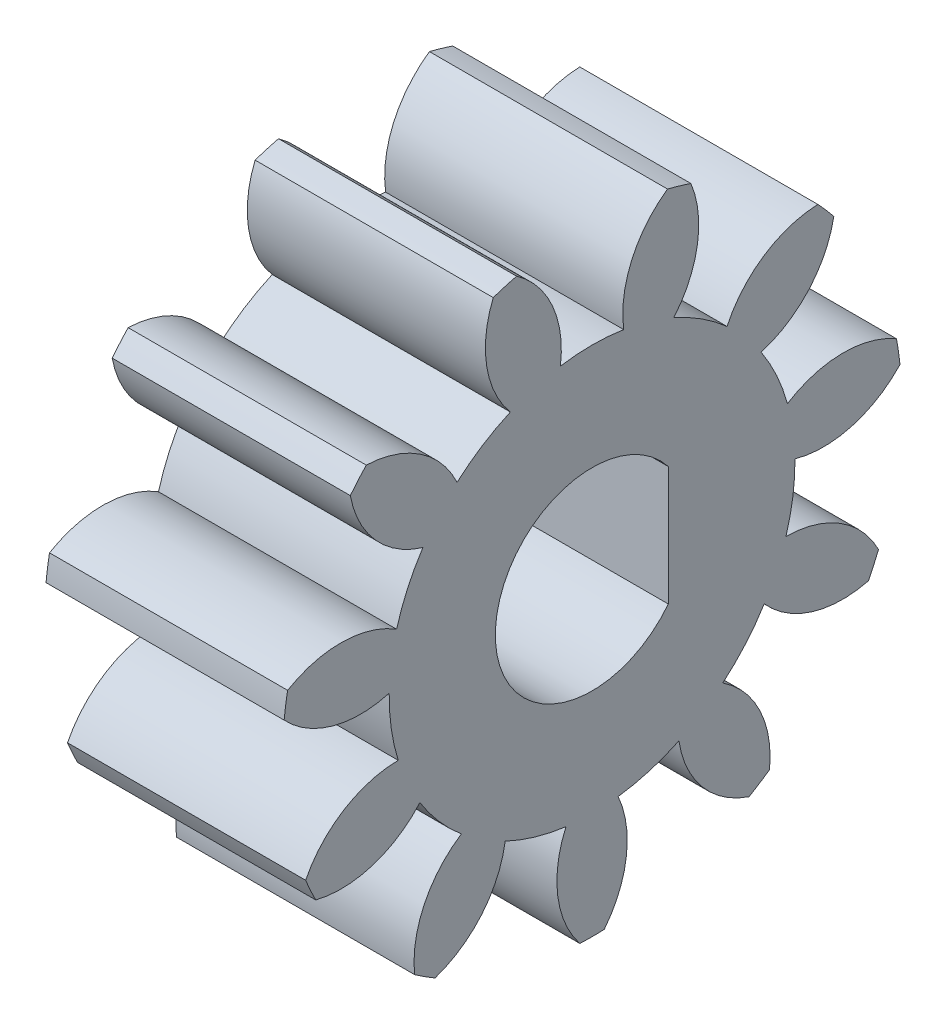
from build123d import *

# Parameters (mm, degrees)
BASPROSKE_W        = 6.35
BASPROSKE_H        = 8.255
TOOTHCUT_DEPTH     = 14.289565456
TEETHCUTS_COUNT    = 11
TEETHCUTS_ANGLE    = 327.272727273
BORSKE_R           = 1.5875
BORE_DEPTH         = 50.8000508
SKETCH1_R          = 1.5875
CUT_EXTRUDE1_DEPTH = 14.262197482


with BuildPart() as part:
    # BasProSke → Base-Revolve (revolve)
    with BuildSketch(Plane(origin=(0, 0, 0), x_dir=(1, 0, 0), z_dir=(0, 1, 0)), mode=Mode.PRIVATE) as base_revolve_sk:
        with Locations((3.175, 4.1275)):
            Rectangle(BASPROSKE_W, BASPROSKE_H)
    revolve(base_revolve_sk.sketch.rotate(Axis((-10, 0, 0), (1, 0, 0)), 180), axis=Axis((-10, 0, 0), (1, 0, 0)))

    # TooCutSke → ToothCut (cut, through all)
    with BuildSketch(Plane(origin=(0, 0, 0), x_dir=(0, 0, -1), z_dir=(1, 0, 0))):
        with BuildLine():
            ThreePointArc((0.844285256, 5.34391677), (0, 5.4102), (-0.844285256, 5.34391677))
            ThreePointArc((-0.844285256, 5.34391677), (-1.061642965, 6.854251062), (-2.040080862, 8.025153845))
            ThreePointArc((-2.040080862, 8.025153845), (0, 8.2804), (2.040080862, 8.025153845))
            ThreePointArc((2.040080862, 8.025153845), (1.061642965, 6.854251062), (0.844285256, 5.34391677))
        make_face()
    toothcut = extrude(amount=TOOTHCUT_DEPTH, mode=Mode.SUBTRACT)

    # TeethCuts: ToothCut ×11 about axis
    teethcuts_axis = Axis((-10, 0, 0), (1, 0, 0))
    for i in range(1, TEETHCUTS_COUNT):
        add(toothcut.rotate(teethcuts_axis, i * TEETHCUTS_ANGLE / (TEETHCUTS_COUNT - 1)), mode=Mode.SUBTRACT)

    # BorSke → Bore (cut, symmetric)
    with BuildSketch(Plane(origin=(0, 0, 0), x_dir=(0, 0, -1), z_dir=(1, 0, 0))):
        with Locations(Location((0, 0, 0), (0, 0, 180))):
            Circle(BORSKE_R)
    extrude(amount=BORE_DEPTH, both=True, mode=Mode.SUBTRACT)

    # Sketch1 → Cut-Extrude1 (cut, through all)
    with BuildSketch(Plane(origin=(6.35, 0, 0), x_dir=(0, 0, -1), z_dir=(1, 0, 0))):
        with BuildLine():
            Line((2.033379293, -1.5875), (2.033379293, 1.5875))
            ThreePointArc((2.033379293, 1.5875), (-2.5796875, 0), (2.033379293, -1.5875))
        make_face()
        Circle(SKETCH1_R, mode=Mode.SUBTRACT)
    extrude(amount=-CUT_EXTRUDE1_DEPTH, mode=Mode.SUBTRACT)


solid = part.part
